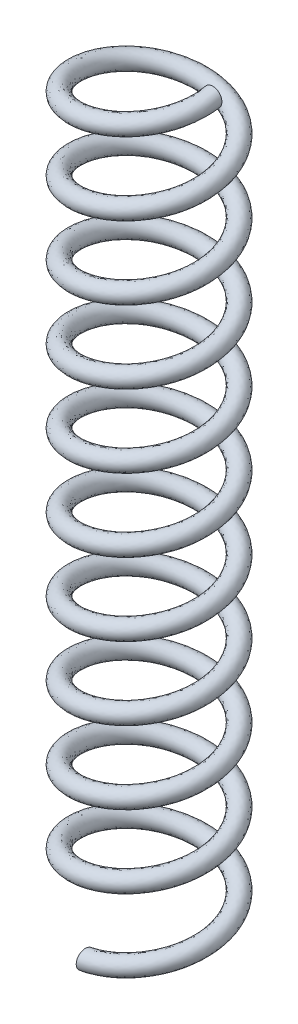
from build123d import *

# Parameters (mm, degrees)
SPRING_PITCH          = 2
SPRING_HEIGHT         = 20.5
SPRING_RADIUS         = 1.75
SPRING_START_ANGLE    = 90
SPRINGBODYDIAMETERS_R = 0.25


with BuildPart() as part:
    # SPRING: sweep along a helix
    with BuildLine() as spring_path:
        add(Helix(SPRING_PITCH, SPRING_HEIGHT, SPRING_RADIUS, center=(0, 0, 0), direction=(0, -1, 0), mode=Mode.PRIVATE).rotate(Axis((0, 0, 0), (0, -1, 0)), SPRING_START_ANGLE))
    # SpringBodyDiameterS → SPRING (sweep)
    with BuildSketch(Plane.XY):
        with Locations((1.75, 0)):
            Circle(SPRINGBODYDIAMETERS_R)
    sweep(path=spring_path.line, is_frenet=True)


solid = part.part
